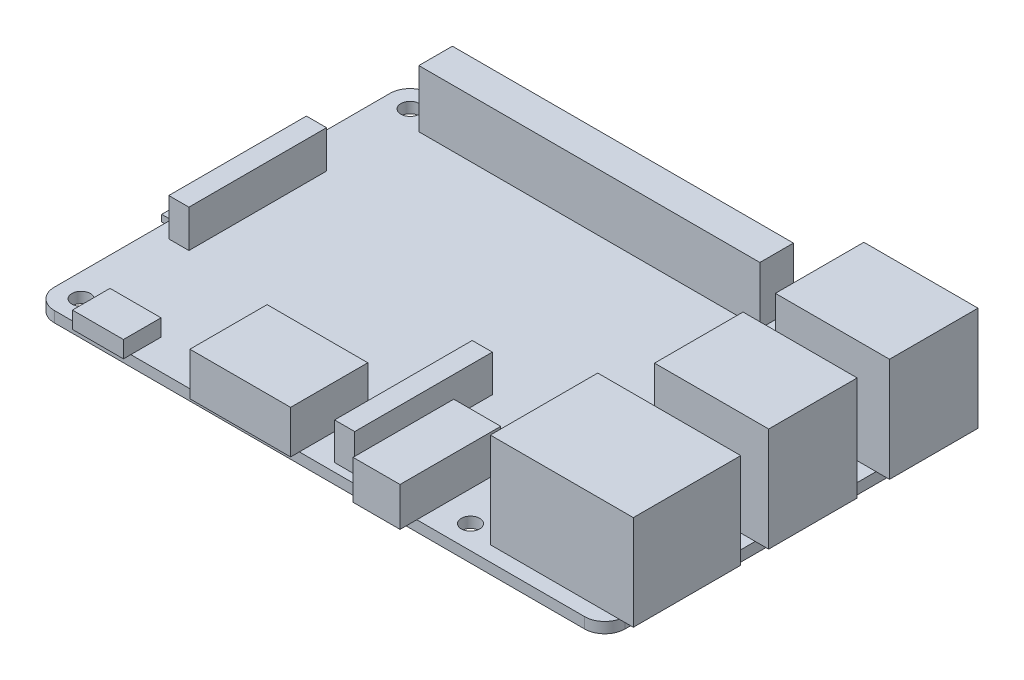
from build123d import *

# Parameters (mm, degrees)
PCB_DEPTH              = 1.6
MOUNT_HOLES_D          = 2.75
SKETCH5_W              = 17
SKETCH5_H              = 13.18
USB_HOST_DEPTH         = 15.5
SKETCH6_W              = 21.3
SKETCH6_H              = 16
ETHERNET_DEPTH         = 14.15
SKETCH7_W              = 3
SKETCH7_H              = 20.5
CAMERA_CONNECTOR_DEPTH = 5.5
SKETCH9_W              = 15
SKETCH9_H              = 11.5
HDMI_DEPTH             = 6.4
SKETCH10_W             = 7
SKETCH10_H             = 15
AV_DEPTH               = 5.8
SKETCH12_W             = 7.6
SKETCH12_H             = 5.6
USB_MICRO_DEPTH        = 2.5
SKETCH13_W             = 3
SKETCH13_H             = 20.5
DISPLAY_DEPTH          = 5.6
SKETCH14_W             = 50.8
SKETCH14_H             = 5
GPIO_DEPTH             = 8.54
SKETCH15_W             = 17
SKETCH15_H             = 11
USD_CARD_DEPTH         = 1


with BuildPart() as part:
    # Sketch2 → PCB (new body)
    with BuildSketch(Plane(origin=(0, 0, 0), x_dir=(1, 0, 0), z_dir=(0, 1, 0))):
        with BuildLine():
            Line((3, 0), (82, 0))
            ThreePointArc((82, 0), (84.121320344, 0.878679656), (85, 3))
            Line((85, 3), (85, 53))
            ThreePointArc((85, 53), (84.121320344, 55.121320344), (82, 56))
            Line((82, 56), (3, 56))
            ThreePointArc((3, 56), (0.878679656, 55.121320344), (0, 53))
            Line((0, 53), (0, 3))
            ThreePointArc((0, 3), (0.878679656, 0.878679656), (3, 0))
        make_face()
    extrude(amount=PCB_DEPTH)

    # Mount Holes (through all)
    with Locations(Plane(origin=(0, 1.6, 0), x_dir=(1, 0, 0), z_dir=(0, 1, 0))):
        with Locations((3.5, 3.5), (3.5, 52.5), (61.5, 52.5), (61.5, 3.5)):
            Hole(MOUNT_HOLES_D / 2)

    # Sketch5 → USB Host (add)
    with BuildSketch(Plane(origin=(0, 1.6, 0), x_dir=(1, 0, 0), z_dir=(0, 1, 0))):
        with Locations((78.5, 47)):
            Rectangle(SKETCH5_W, SKETCH5_H)
        with Locations((78.5, 29)):
            Rectangle(SKETCH5_W, SKETCH5_H)
    extrude(amount=USB_HOST_DEPTH)

    # Sketch6 → Ethernet (add)
    with BuildSketch(Plane(origin=(0, 1.6, 0), x_dir=(1, 0, 0), z_dir=(0, 1, 0))):
        with Locations((76.35, 10.25)):
            Rectangle(SKETCH6_W, SKETCH6_H)
    extrude(amount=ETHERNET_DEPTH)

    # Sketch7 → Camera Connector (add)
    with BuildSketch(Plane(origin=(0, 1.6, 0), x_dir=(1, 0, 0), z_dir=(0, 1, 0))):
        with Locations((45, 11.5)):
            Rectangle(SKETCH7_W, SKETCH7_H)
    extrude(amount=CAMERA_CONNECTOR_DEPTH)

    # Sketch9 → HDMI (add)
    with BuildSketch(Plane(origin=(0, 1.6, 0), x_dir=(1, 0, 0), z_dir=(0, 1, 0))):
        with Locations((32, 4.45)):
            Rectangle(SKETCH9_W, SKETCH9_H)
    extrude(amount=HDMI_DEPTH)

    # Sketch10 → AV (add)
    with BuildSketch(Plane(origin=(0, 1.6, 0), x_dir=(1, 0, 0), z_dir=(0, 1, 0))):
        with Locations((53.5, 5)):
            Rectangle(SKETCH10_W, SKETCH10_H)
    extrude(amount=AV_DEPTH)

    # Sketch12 → USB-Micro (add)
    with BuildSketch(Plane(origin=(0, 1.6, 0), x_dir=(1, 0, 0), z_dir=(0, 1, 0))):
        with Locations((10.6, 1.7)):
            Rectangle(SKETCH12_W, SKETCH12_H)
    extrude(amount=USB_MICRO_DEPTH)

    # Sketch13 → Display (add)
    with BuildSketch(Plane(origin=(0, 1.6, 0), x_dir=(1, 0, 0), z_dir=(0, 1, 0))):
        with Locations((3.8, 28)):
            Rectangle(SKETCH13_W, SKETCH13_H)
    extrude(amount=DISPLAY_DEPTH)

    # Sketch14 → GPIO (add)
    with BuildSketch(Plane(origin=(0, 1.6, 0), x_dir=(1, 0, 0), z_dir=(0, 1, 0))):
        with Locations((32.5, 52.7)):
            Rectangle(SKETCH14_W, SKETCH14_H)
    extrude(amount=GPIO_DEPTH)

    # Sketch15 → uSD Card (add)
    with BuildSketch(Plane.XZ):
        with Locations((5.5, -27.5)):
            Rectangle(SKETCH15_W, SKETCH15_H)
    extrude(amount=USD_CARD_DEPTH)


solid = part.part
